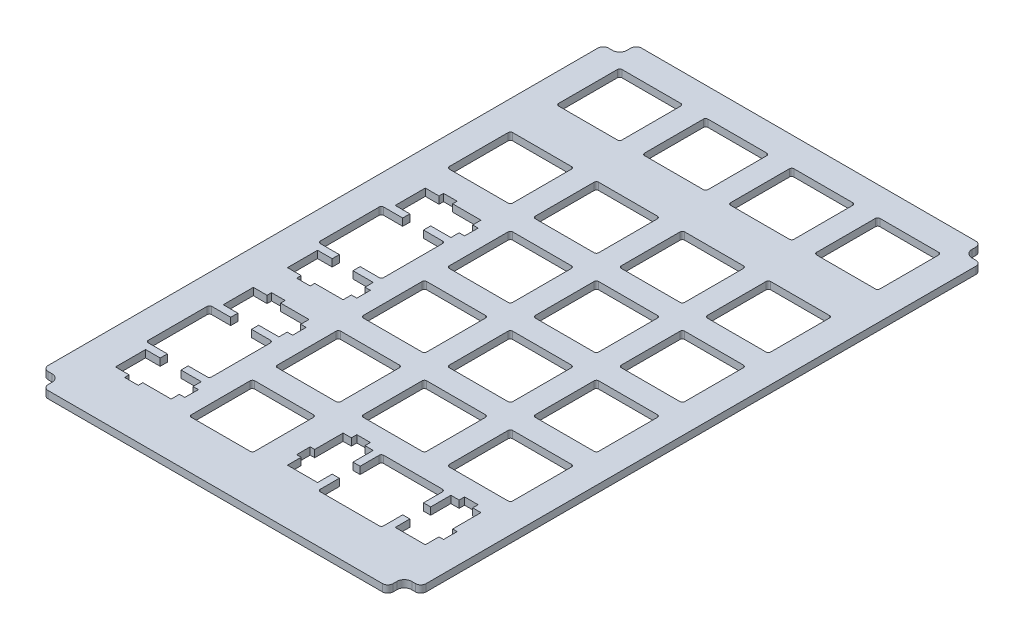
from build123d import *

# Parameters (mm, degrees)
EXTRUDE_1_DEPTH             = 1.6
CUT_EXTRUDE_3_REACH         = 143.87
PATTERN_LINEAR_1_COUNT      = 5
PATTERN_LINEAR_1_PITCH      = 19
PATTERN_LINEAR_1_COUNT_DIR2 = 4
PATTERN_LINEAR_1_PITCH_DIR2 = 19
PATTERN_LINEAR_2_COUNT      = 2
PATTERN_LINEAR_2_PITCH      = 100.15
PATTERN_LINEAR_2_COUNT_DIR2 = 4
PATTERN_LINEAR_2_PITCH_DIR2 = 19
CUT_EXTRUDE_2_DEPTH         = 1.6
SKETCH_7_W                  = 35.521117503
SKETCH_7_H                  = 15.86551154
EXTRUDE_2_DEPTH             = 1.6
CUT_EXTRUDE_4_DEPTH         = 1.6


with BuildPart() as part:
    # 草图1 → 凸台-拉伸1 (new body)
    with BuildSketch(Plane(origin=(0, 0, 0), x_dir=(1, 0, 0), z_dir=(0, 1, 0))):
        with BuildLine():
            Line((-11.350806884, 119.165811453), (-10.500806884, 119.165811453))
            ThreePointArc((-10.500806884, 119.165811453), (-9.334080695, 119.649085264), (-8.850806884, 120.815811453))
            Line((-8.850806884, 120.815811453), (-8.850806884, 121.665811453))
            ThreePointArc((-8.850806884, 121.665811453), (-8.513979683, 122.478984252), (-7.700806884, 122.815811453))
            Line((-7.700806884, 122.815811453), (66.199193116, 122.815811453))
            ThreePointArc((66.199193116, 122.815811453), (67.012365914, 122.478984252), (67.349193116, 121.665811453))
            Line((67.349193116, 121.665811453), (67.349193116, 120.815811453))
            ThreePointArc((67.349193116, 120.815811453), (67.832466927, 119.649085264), (68.999193116, 119.165811453))
            Line((68.999193116, 119.165811453), (69.849193116, 119.165811453))
            ThreePointArc((69.849193116, 119.165811453), (70.662365914, 118.828984252), (70.999193116, 118.015811453))
            Line((70.999193116, 118.015811453), (70.999193116, -3.47167721))
            ThreePointArc((70.999193116, -3.47167721), (70.662365914, -4.284850009), (69.849193116, -4.62167721))
            Line((69.849193116, -4.62167721), (68.999193116, -4.62167721))
            ThreePointArc((68.999193116, -4.62167721), (67.832466927, -5.104951021), (67.349193116, -6.27167721))
            Line((67.349193116, -6.27167721), (67.349193116, -7.12167721))
            ThreePointArc((67.349193116, -7.12167721), (67.012365914, -7.934850009), (66.199193116, -8.27167721))
            Line((66.199193116, -8.27167721), (-7.700806884, -8.27167721))
            ThreePointArc((-7.700806884, -8.27167721), (-8.513979683, -7.934850009), (-8.850806884, -7.12167721))
            Line((-8.850806884, -7.12167721), (-8.850806884, -6.27167721))
            ThreePointArc((-8.850806884, -6.27167721), (-9.334080695, -5.104951021), (-10.500806884, -4.62167721))
            Line((-10.500806884, -4.62167721), (-11.350806884, -4.62167721))
            ThreePointArc((-11.350806884, -4.62167721), (-12.163979683, -4.284850009), (-12.500806884, -3.47167721))
            Line((-12.500806884, -3.47167721), (-12.500806884, 118.015811453))
            ThreePointArc((-12.500806884, 118.015811453), (-12.163979683, 118.828984252), (-11.350806884, 119.165811453))
        make_face()
    extrude(amount=EXTRUDE_1_DEPTH)

    # 草图6 → 切除-拉伸3 (cut, up to next)
    with BuildSketch(Plane.XZ, mode=Mode.PRIVATE) as cut_extrude_3_sk1:
        with BuildLine():
            Line((51.249193116, -2.415811453), (64.249193116, -2.415811453))
            ThreePointArc((64.249193116, -2.415811453), (64.602746506, -2.562258063), (64.749193116, -2.915811453))
            Line((64.749193116, -2.915811453), (64.749193116, -15.915811453))
            ThreePointArc((64.749193116, -15.915811453), (64.602746506, -16.269364844), (64.249193116, -16.415811453))
            Line((64.249193116, -16.415811453), (51.249193116, -16.415811453))
            ThreePointArc((51.249193116, -16.415811453), (50.895639725, -16.269364844), (50.749193116, -15.915811453))
            Line((50.749193116, -15.915811453), (50.749193116, -2.915811453))
            ThreePointArc((50.749193116, -2.915811453), (50.895639725, -2.562258063), (51.249193116, -2.415811453))
        make_face()
    cut_extrude_3_tool1 = extrude(cut_extrude_3_sk1.sketch, amount=-CUT_EXTRUDE_3_REACH, mode=Mode.PRIVATE) & part.part
    cut_extrude_3 = cut_extrude_3_tool1.solids().sort_by_distance((57.749193, 0, -9.415811))[0]
    add(cut_extrude_3, mode=Mode.SUBTRACT)

    # 阵列(线性)1: Cut-Extrude 3 5 × 4, 4 skipped
    with Locations(*[(-j * PATTERN_LINEAR_1_PITCH_DIR2, 0, -i * PATTERN_LINEAR_1_PITCH) for i in range(PATTERN_LINEAR_1_COUNT) for j in range(PATTERN_LINEAR_1_COUNT_DIR2) if (i, j) not in ((0, 0), (0, 3), (1, 3), (2, 3), (3, 3))]):
        add(cut_extrude_3, mode=Mode.SUBTRACT)

    # 阵列(线性)2: Cut-Extrude 3 2 × 4, 3 skipped
    with Locations(*[(-j * PATTERN_LINEAR_2_PITCH_DIR2, 0, -i * PATTERN_LINEAR_2_PITCH) for i in range(PATTERN_LINEAR_2_COUNT) for j in range(PATTERN_LINEAR_2_COUNT_DIR2) if (i, j) not in ((0, 0), (0, 1), (0, 2), (0, 3))]):
        add(cut_extrude_3, mode=Mode.SUBTRACT)

    # 草图3 → 切除-拉伸2 (cut)
    with BuildSketch(Plane(origin=(0, 1.6, 0), x_dir=(1, 0, 0), z_dir=(0, 1, 0))):
        with BuildLine():
            Line((-6.250806884, 12.415811453), (-6.250806884, 25.415811453))
            ThreePointArc((-6.250806884, 25.415811453), (-6.104360275, 25.769364844), (-5.750806884, 25.915811453))
            Line((-5.750806884, 25.915811453), (-1.550806884, 25.915811453))
            Line((-1.550806884, 25.915811453), (-1.550806884, 27.495811453))
            Line((-1.550806884, 27.495811453), (-4.780806884, 27.495811453))
            Line((-4.780806884, 27.495811453), (-4.780806884, 34.145811453))
            Line((-4.780806884, 34.145811453), (-1.750806884, 34.145811453))
            Line((-1.750806884, 34.145811453), (-1.750806884, 35.145811453))
            Line((-1.750806884, 35.145811453), (1.249193116, 35.145811453))
            Line((1.249193116, 35.145811453), (1.249193116, 34.145811453))
            Line((1.249193116, 34.145811453), (7.519193116, 34.145811453))
            Line((7.519193116, 34.145811453), (7.519193116, 32.320811453))
            Line((7.519193116, 32.320811453), (8.719193116, 32.320811453))
            Line((8.719193116, 32.320811453), (8.719193116, 29.320811453))
            Line((8.719193116, 29.320811453), (7.519193116, 29.320811453))
            Line((7.519193116, 29.320811453), (7.519193116, 27.495811453))
            Line((7.519193116, 27.495811453), (3.049193116, 27.495811453))
            Line((3.049193116, 27.495811453), (3.049193116, 25.915811453))
            Line((3.049193116, 25.915811453), (7.249193116, 25.915811453))
            ThreePointArc((7.249193116, 25.915811453), (7.602746506, 25.769364844), (7.749193116, 25.415811453))
            Line((7.749193116, 25.415811453), (7.749193116, 12.415811453))
            ThreePointArc((7.749193116, 12.415811453), (7.602746506, 12.062258063), (7.249193116, 11.915811453))
            Line((7.249193116, 11.915811453), (3.049193116, 11.915811453))
            Line((3.049193116, 11.915811453), (3.049193116, 10.335811453))
            Line((3.049193116, 10.335811453), (7.519193116, 10.335811453))
            Line((7.519193116, 10.335811453), (7.519193116, 8.510811453))
            Line((7.519193116, 8.510811453), (8.719193116, 8.510811453))
            Line((8.719193116, 8.510811453), (8.719193116, 5.510811453))
            Line((8.719193116, 5.510811453), (7.519193116, 5.510811453))
            Line((7.519193116, 5.510811453), (7.519193116, 3.685811453))
            Line((7.519193116, 3.685811453), (1.249193116, 3.685811453))
            Line((1.249193116, 3.685811453), (1.249193116, 2.685811453))
            Line((1.249193116, 2.685811453), (-1.750806884, 2.685811453))
            Line((-1.750806884, 2.685811453), (-1.750806884, 3.685811453))
            Line((-1.750806884, 3.685811453), (-4.780806884, 3.685811453))
            Line((-4.780806884, 3.685811453), (-4.780806884, 10.335811453))
            Line((-4.780806884, 10.335811453), (-1.550806884, 10.335811453))
            Line((-1.550806884, 10.335811453), (-1.550806884, 11.915811453))
            Line((-1.550806884, 11.915811453), (-5.750806884, 11.915811453))
            ThreePointArc((-5.750806884, 11.915811453), (-6.104360275, 12.062258063), (-6.250806884, 12.415811453))
        make_face()
        with BuildLine():
            Line((-6.250806884, 50.415811453), (-6.250806884, 63.415811453))
            ThreePointArc((-6.250806884, 63.415811453), (-6.104360275, 63.769364844), (-5.750806884, 63.915811453))
            Line((-5.750806884, 63.915811453), (-1.550806884, 63.915811453))
            Line((-1.550806884, 63.915811453), (-1.550806884, 65.495811453))
            Line((-1.550806884, 65.495811453), (-4.780806884, 65.495811453))
            Line((-4.780806884, 65.495811453), (-4.780806884, 72.145811453))
            Line((-4.780806884, 72.145811453), (-1.750806884, 72.145811453))
            Line((-1.750806884, 72.145811453), (-1.750806884, 73.145811453))
            Line((-1.750806884, 73.145811453), (1.249193116, 73.145811453))
            Line((1.249193116, 73.145811453), (1.249193116, 72.145811453))
            Line((1.249193116, 72.145811453), (7.519193116, 72.145811453))
            Line((7.519193116, 72.145811453), (7.519193116, 70.320811453))
            Line((7.519193116, 70.320811453), (8.719193116, 70.320811453))
            Line((8.719193116, 70.320811453), (8.719193116, 67.320811453))
            Line((8.719193116, 67.320811453), (7.519193116, 67.320811453))
            Line((7.519193116, 67.320811453), (7.519193116, 65.495811453))
            Line((7.519193116, 65.495811453), (3.049193116, 65.495811453))
            Line((3.049193116, 65.495811453), (3.049193116, 63.915811453))
            Line((3.049193116, 63.915811453), (7.249193116, 63.915811453))
            ThreePointArc((7.249193116, 63.915811453), (7.602746506, 63.769364844), (7.749193116, 63.415811453))
            Line((7.749193116, 63.415811453), (7.749193116, 50.415811453))
            ThreePointArc((7.749193116, 50.415811453), (7.602746506, 50.062258063), (7.249193116, 49.915811453))
            Line((7.249193116, 49.915811453), (3.049193116, 49.915811453))
            Line((3.049193116, 49.915811453), (3.049193116, 48.335811453))
            Line((3.049193116, 48.335811453), (7.519193116, 48.335811453))
            Line((7.519193116, 48.335811453), (7.519193116, 46.510811453))
            Line((7.519193116, 46.510811453), (8.719193116, 46.510811453))
            Line((8.719193116, 46.510811453), (8.719193116, 43.510811453))
            Line((8.719193116, 43.510811453), (7.519193116, 43.510811453))
            Line((7.519193116, 43.510811453), (7.519193116, 41.685811453))
            Line((7.519193116, 41.685811453), (1.249193116, 41.685811453))
            Line((1.249193116, 41.685811453), (1.249193116, 40.685811453))
            Line((1.249193116, 40.685811453), (-1.750806884, 40.685811453))
            Line((-1.750806884, 40.685811453), (-1.750806884, 41.685811453))
            Line((-1.750806884, 41.685811453), (-4.780806884, 41.685811453))
            Line((-4.780806884, 41.685811453), (-4.780806884, 48.335811453))
            Line((-4.780806884, 48.335811453), (-1.550806884, 48.335811453))
            Line((-1.550806884, 48.335811453), (-1.550806884, 49.915811453))
            Line((-1.550806884, 49.915811453), (-5.750806884, 49.915811453))
            ThreePointArc((-5.750806884, 49.915811453), (-6.104360275, 50.062258063), (-6.250806884, 50.415811453))
        make_face()
    extrude(amount=-CUT_EXTRUDE_2_DEPTH, mode=Mode.SUBTRACT)

    # 草图7 → 凸台-拉伸2 (add)
    with BuildSketch(Plane(origin=(0, 1.6, 0), x_dir=(1, 0, 0), z_dir=(0, 1, 0))):
        with Locations((48.619669698, 9.052037262)):
            Rectangle(SKETCH_7_W, SKETCH_7_H)
    extrude(amount=-EXTRUDE_2_DEPTH)

    # 草图8 → 切除-拉伸4 (cut)
    with BuildSketch(Plane(origin=(0, 1.6, 0), x_dir=(1, 0, 0), z_dir=(0, 1, 0))):
        with BuildLine():
            Line((58.654193116, 16.185811453), (56.829193116, 16.185811453))
            Line((56.829193116, 16.185811453), (56.829193116, 11.715811453))
            Line((56.829193116, 11.715811453), (55.249193116, 11.715811453))
            Line((55.249193116, 11.715811453), (55.249193116, 15.915811453))
            ThreePointArc((55.249193116, 15.915811453), (55.102746506, 16.269364844), (54.749193116, 16.415811453))
            Line((54.749193116, 16.415811453), (41.749193116, 16.415811453))
            ThreePointArc((41.749193116, 16.415811453), (41.395639725, 16.269364844), (41.249193116, 15.915811453))
            Line((41.249193116, 15.915811453), (41.249193116, 11.715811453))
            Line((41.249193116, 11.715811453), (39.669193116, 11.715811453))
            Line((39.669193116, 11.715811453), (39.669193116, 16.185811453))
            Line((39.669193116, 16.185811453), (37.844193116, 16.185811453))
            Line((37.844193116, 16.185811453), (37.844193116, 17.385811453))
            Line((37.844193116, 17.385811453), (34.844193116, 17.385811453))
            Line((34.844193116, 17.385811453), (34.844193116, 16.185811453))
            Line((34.844193116, 16.185811453), (33.019193116, 16.185811453))
            Line((33.019193116, 16.185811453), (33.019193116, 9.915811453))
            Line((33.019193116, 9.915811453), (32.019193116, 9.915811453))
            Line((32.019193116, 9.915811453), (32.019193116, 6.915811453))
            Line((32.019193116, 6.915811453), (33.019193116, 6.915811453))
            Line((33.019193116, 6.915811453), (33.019193116, 3.885811453))
            Line((33.019193116, 3.885811453), (39.669193116, 3.885811453))
            Line((39.669193116, 3.885811453), (39.669193116, 7.115811453))
            Line((39.669193116, 7.115811453), (41.249193116, 7.115811453))
            Line((41.249193116, 7.115811453), (41.249193116, 2.915811453))
            ThreePointArc((41.249193116, 2.915811453), (41.395639725, 2.562258063), (41.749193116, 2.415811453))
            Line((41.749193116, 2.415811453), (54.749193116, 2.415811453))
            ThreePointArc((54.749193116, 2.415811453), (55.102746506, 2.562258063), (55.249193116, 2.915811453))
            Line((55.249193116, 2.915811453), (55.249193116, 7.115811453))
            Line((55.249193116, 7.115811453), (56.829193116, 7.115811453))
            Line((56.829193116, 7.115811453), (56.829193116, 3.885811453))
            Line((56.829193116, 3.885811453), (63.479193116, 3.885811453))
            Line((63.479193116, 3.885811453), (63.479193116, 6.915811453))
            Line((63.479193116, 6.915811453), (64.479193116, 6.915811453))
            Line((64.479193116, 6.915811453), (64.479193116, 9.915811453))
            Line((64.479193116, 9.915811453), (63.479193116, 9.915811453))
            Line((63.479193116, 9.915811453), (63.479193116, 16.185811453))
            Line((63.479193116, 16.185811453), (61.654193116, 16.185811453))
            Line((61.654193116, 16.185811453), (61.654193116, 17.385811453))
            Line((61.654193116, 17.385811453), (58.654193116, 17.385811453))
            Line((58.654193116, 17.385811453), (58.654193116, 16.185811453))
        make_face()
    extrude(amount=-CUT_EXTRUDE_4_DEPTH, mode=Mode.SUBTRACT)


solid = part.part
